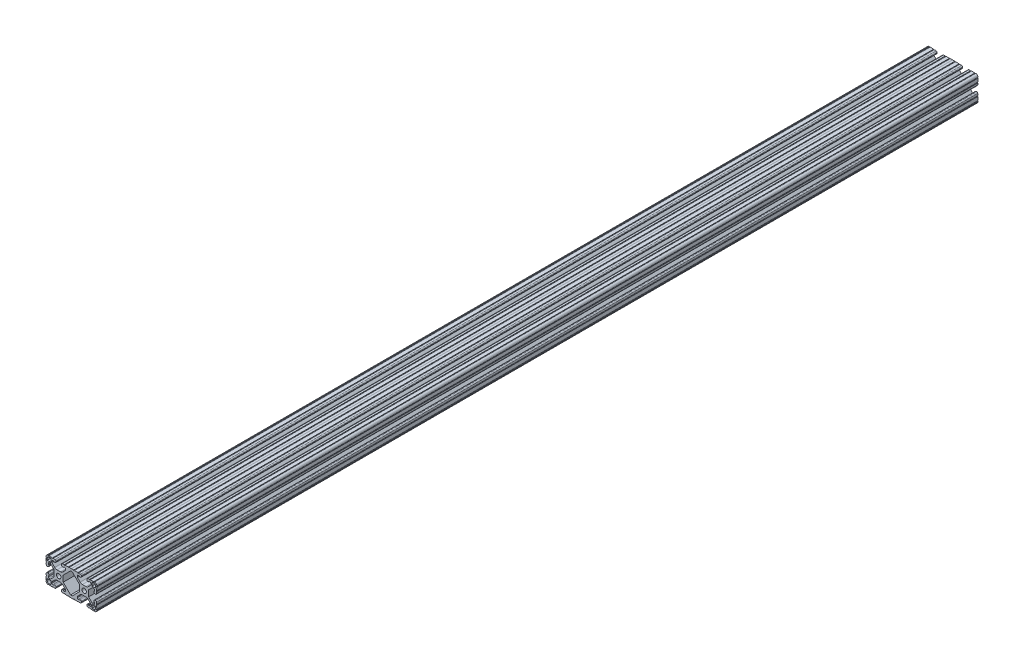
from build123d import *

# Parameters (mm, degrees)
SKETCH3_R          = 3.3274
EXTRUDE1_DEPTH     = 914.4
SKETCH4_W          = 79.082688122
SKETCH4_H          = 39.718116723
CUT_EXTRUDE1_DEPTH = 508


with BuildPart() as part:
    # Sketch3 → Extrude1 (new, symmetric)
    with BuildSketch(Plane.XY):
        with BuildLine():
            Line((15.764194098, 19.048065876), (19.05, 19.16278985))
            Line((19.05, 19.16278985), (22.335805902, 19.048065876))
            Line((22.335805902, 19.048065876), (22.405105476, 19.045645881))
            ThreePointArc((22.405105476, 19.045645881), (22.993059391, 18.4151425), (23.623562772, 19.003096415))
            Line((23.623562772, 19.003096415), (28.755105476, 18.823898995))
            ThreePointArc((28.755105476, 18.823898995), (29.343059391, 18.193395614), (29.973562772, 18.781349529))
            Line((29.973562772, 18.781349529), (32.517119053, 18.692526586))
            ThreePointArc((32.517119053, 18.692526586), (33.613895135, 18.192696929), (34.036, 17.063726184))
            Line((34.036, 17.063726184), (34.007633689, 16.25142132))
            ThreePointArc((34.007633689, 16.25142132), (33.507804032, 15.154645238), (32.378833287, 14.732540373))
            Line((32.378833287, 14.732540373), (31.2293, 14.732540373))
            Line((31.2293, 14.732540373), (31.2293, 15.644526586))
            Line((31.2293, 15.644526586), (29.083, 15.644526586))
            ThreePointArc((29.083, 15.644526586), (28.184974388, 15.272552198), (27.813, 14.374526586))
            Line((27.813, 14.374526586), (27.813, 12.968312693))
            ThreePointArc((27.813, 12.968312693), (27.909672994, 12.482304734), (28.184974388, 12.070287081))
            Line((28.184974388, 12.070287081), (32.107677258, 8.147584211))
            ThreePointArc((32.107677258, 8.147584211), (33.648623281, 7.117956996), (35.466293048, 6.7564))
            Line((35.466293048, 6.7564), (40.733706952, 6.7564))
            ThreePointArc((40.733706952, 6.7564), (42.551376719, 7.117956996), (44.092322742, 8.147584211))
            Line((44.092322742, 8.147584211), (48.015025612, 12.070287081))
            ThreePointArc((48.015025612, 12.070287081), (48.290327006, 12.482304734), (48.387, 12.968312693))
            Line((48.387, 12.968312693), (48.387, 14.374526586))
            ThreePointArc((48.387, 14.374526586), (48.015025612, 15.272552198), (47.117, 15.644526586))
            Line((47.117, 15.644526586), (44.9707, 15.644526586))
            Line((44.9707, 15.644526586), (44.9707, 14.732540373))
            Line((44.9707, 14.732540373), (43.821166713, 14.732540373))
            ThreePointArc((43.821166713, 14.732540373), (42.692195968, 15.154645238), (42.192366311, 16.25142132))
            Line((42.192366311, 16.25142132), (42.164, 17.063726184))
            ThreePointArc((42.164, 17.063726184), (42.586104865, 18.192696929), (43.682880947, 18.692526586))
            Line((43.682880947, 18.692526586), (46.226437228, 18.781349529))
            ThreePointArc((46.226437228, 18.781349529), (46.856940609, 18.193395614), (47.444894524, 18.823898995))
            Line((47.444894524, 18.823898995), (52.576437228, 19.003096415))
            ThreePointArc((52.576437228, 19.003096415), (53.206940609, 18.4151425), (53.794894524, 19.045645881))
            Line((53.794894524, 19.045645881), (53.864194098, 19.048065876))
            ThreePointArc((53.864194098, 19.048065876), (56.22006403, 18.12006403), (57.148065876, 15.764194098))
            Line((57.148065876, 15.764194098), (57.145645881, 15.694894524))
            ThreePointArc((57.145645881, 15.694894524), (56.5151425, 15.106940609), (57.103096415, 14.476437228))
            Line((57.103096415, 14.476437228), (56.923898995, 9.344894524))
            ThreePointArc((56.923898995, 9.344894524), (56.293395614, 8.756940609), (56.881349529, 8.126437228))
            Line((56.881349529, 8.126437228), (56.792526586, 5.582880947))
            ThreePointArc((56.792526586, 5.582880947), (56.292696929, 4.486104865), (55.163726184, 4.064))
            Line((55.163726184, 4.064), (54.35142132, 4.092366311))
            ThreePointArc((54.35142132, 4.092366311), (53.254645238, 4.592195968), (52.832540373, 5.721166713))
            Line((52.832540373, 5.721166713), (52.832540373, 6.8707))
            Line((52.832540373, 6.8707), (53.744526586, 6.8707))
            Line((53.744526586, 6.8707), (53.744526586, 9.017))
            ThreePointArc((53.744526586, 9.017), (53.372552198, 9.915025612), (52.474526586, 10.287))
            Line((52.474526586, 10.287), (50.542261469, 10.287))
            Line((50.542261469, 10.287), (44.8564, 4.601138531))
            Line((44.8564, 4.601138531), (44.8564, -4.601138531))
            Line((44.8564, -4.601138531), (50.542261469, -10.287))
            Line((50.542261469, -10.287), (52.474526586, -10.287))
            ThreePointArc((52.474526586, -10.287), (53.372552198, -9.915025612), (53.744526586, -9.017))
            Line((53.744526586, -9.017), (53.744526586, -6.8707))
            Line((53.744526586, -6.8707), (52.832540373, -6.8707))
            Line((52.832540373, -6.8707), (52.832540373, -5.721166713))
            ThreePointArc((52.832540373, -5.721166713), (53.254645238, -4.592195968), (54.35142132, -4.092366311))
            Line((54.35142132, -4.092366311), (55.163726184, -4.064))
            ThreePointArc((55.163726184, -4.064), (56.292696929, -4.486104865), (56.792526586, -5.582880947))
            Line((56.792526586, -5.582880947), (56.881349529, -8.126437228))
            ThreePointArc((56.881349529, -8.126437228), (56.293395614, -8.756940609), (56.923898995, -9.344894524))
            Line((56.923898995, -9.344894524), (57.103096415, -14.476437228))
            ThreePointArc((57.103096415, -14.476437228), (56.5151425, -15.106940609), (57.145645881, -15.694894524))
            Line((57.145645881, -15.694894524), (57.148065876, -15.764194098))
            ThreePointArc((57.148065876, -15.764194098), (56.22006403, -18.12006403), (53.864194098, -19.048065876))
            Line((53.864194098, -19.048065876), (53.794894524, -19.045645881))
            ThreePointArc((53.794894524, -19.045645881), (53.206940609, -18.4151425), (52.576437228, -19.003096415))
            Line((52.576437228, -19.003096415), (47.444894524, -18.823898995))
            ThreePointArc((47.444894524, -18.823898995), (46.856940609, -18.193395614), (46.226437228, -18.781349529))
            Line((46.226437228, -18.781349529), (43.682880947, -18.692526586))
            ThreePointArc((43.682880947, -18.692526586), (42.586104865, -18.192696929), (42.164, -17.063726184))
            Line((42.164, -17.063726184), (42.192366311, -16.25142132))
            ThreePointArc((42.192366311, -16.25142132), (42.692195968, -15.154645238), (43.821166713, -14.732540373))
            Line((43.821166713, -14.732540373), (44.9707, -14.732540373))
            Line((44.9707, -14.732540373), (44.9707, -15.644526586))
            Line((44.9707, -15.644526586), (47.117, -15.644526586))
            ThreePointArc((47.117, -15.644526586), (48.015025612, -15.272552198), (48.387, -14.374526586))
            Line((48.387, -14.374526586), (48.387, -12.968312693))
            ThreePointArc((48.387, -12.968312693), (48.290327006, -12.482304734), (48.015025612, -12.070287081))
            Line((48.015025612, -12.070287081), (44.092322742, -8.147584211))
            ThreePointArc((44.092322742, -8.147584211), (42.551376719, -7.117956996), (40.733706952, -6.7564))
            Line((40.733706952, -6.7564), (35.466293048, -6.7564))
            ThreePointArc((35.466293048, -6.7564), (33.648623281, -7.117956996), (32.107677258, -8.147584211))
            Line((32.107677258, -8.147584211), (28.184974388, -12.070287081))
            ThreePointArc((28.184974388, -12.070287081), (27.909672994, -12.482304734), (27.813, -12.968312693))
            Line((27.813, -12.968312693), (27.813, -14.374526586))
            ThreePointArc((27.813, -14.374526586), (28.184974388, -15.272552198), (29.083, -15.644526586))
            Line((29.083, -15.644526586), (31.2293, -15.644526586))
            Line((31.2293, -15.644526586), (31.2293, -14.732540373))
            Line((31.2293, -14.732540373), (32.378833287, -14.732540373))
            ThreePointArc((32.378833287, -14.732540373), (33.507804032, -15.154645238), (34.007633689, -16.25142132))
            Line((34.007633689, -16.25142132), (34.036, -17.063726184))
            ThreePointArc((34.036, -17.063726184), (33.613895135, -18.192696929), (32.517119053, -18.692526586))
            Line((32.517119053, -18.692526586), (29.973562772, -18.781349529))
            ThreePointArc((29.973562772, -18.781349529), (29.343059391, -18.193395614), (28.755105476, -18.823898995))
            Line((28.755105476, -18.823898995), (23.623562772, -19.003096415))
            ThreePointArc((23.623562772, -19.003096415), (22.993059391, -18.4151425), (22.405105476, -19.045645881))
            Line((22.405105476, -19.045645881), (22.335805902, -19.048065876))
            Line((22.335805902, -19.048065876), (19.05, -19.16278985))
            Line((19.05, -19.16278985), (15.764194098, -19.048065876))
            Line((15.764194098, -19.048065876), (15.694894524, -19.045645881))
            ThreePointArc((15.694894524, -19.045645881), (15.106940609, -18.4151425), (14.476437228, -19.003096415))
            Line((14.476437228, -19.003096415), (9.344894524, -18.823898995))
            ThreePointArc((9.344894524, -18.823898995), (8.756940609, -18.193395614), (8.126437228, -18.781349529))
            Line((8.126437228, -18.781349529), (5.582880947, -18.692526586))
            ThreePointArc((5.582880947, -18.692526586), (4.486104865, -18.192696929), (4.064, -17.063726184))
            Line((4.064, -17.063726184), (4.092366311, -16.25142132))
            ThreePointArc((4.092366311, -16.25142132), (4.592195968, -15.154645238), (5.721166713, -14.732540373))
            Line((5.721166713, -14.732540373), (6.8707, -14.732540373))
            Line((6.8707, -14.732540373), (6.8707, -15.644526586))
            Line((6.8707, -15.644526586), (9.017, -15.644526586))
            ThreePointArc((9.017, -15.644526586), (9.915025612, -15.272552198), (10.287, -14.374526586))
            Line((10.287, -14.374526586), (10.287, -12.968312693))
            ThreePointArc((10.287, -12.968312693), (10.190327006, -12.482304734), (9.915025612, -12.070287081))
            Line((9.915025612, -12.070287081), (5.992322742, -8.147584211))
            ThreePointArc((5.992322742, -8.147584211), (4.451376719, -7.117956996), (2.633706952, -6.7564))
            Line((2.633706952, -6.7564), (-2.633706952, -6.7564))
            ThreePointArc((-2.633706952, -6.7564), (-4.451376719, -7.117956996), (-5.992322742, -8.147584211))
            Line((-5.992322742, -8.147584211), (-9.915025612, -12.070287081))
            ThreePointArc((-9.915025612, -12.070287081), (-10.190327006, -12.482304734), (-10.287, -12.968312693))
            Line((-10.287, -12.968312693), (-10.287, -14.374526586))
            ThreePointArc((-10.287, -14.374526586), (-9.915025612, -15.272552198), (-9.017, -15.644526586))
            Line((-9.017, -15.644526586), (-6.8707, -15.644526586))
            Line((-6.8707, -15.644526586), (-6.8707, -14.732540373))
            Line((-6.8707, -14.732540373), (-5.721166713, -14.732540373))
            ThreePointArc((-5.721166713, -14.732540373), (-4.592195968, -15.154645238), (-4.092366311, -16.25142132))
            Line((-4.092366311, -16.25142132), (-4.064, -17.063726184))
            ThreePointArc((-4.064, -17.063726184), (-4.486104865, -18.192696929), (-5.582880947, -18.692526586))
            Line((-5.582880947, -18.692526586), (-8.126437228, -18.781349529))
            ThreePointArc((-8.126437228, -18.781349529), (-8.756940609, -18.193395614), (-9.344894524, -18.823898995))
            Line((-9.344894524, -18.823898995), (-14.476437228, -19.003096415))
            ThreePointArc((-14.476437228, -19.003096415), (-15.106940609, -18.4151425), (-15.694894524, -19.045645881))
            Line((-15.694894524, -19.045645881), (-15.764194098, -19.048065876))
            ThreePointArc((-15.764194098, -19.048065876), (-18.12006403, -18.12006403), (-19.048065876, -15.764194098))
            Line((-19.048065876, -15.764194098), (-19.045645881, -15.694894524))
            ThreePointArc((-19.045645881, -15.694894524), (-18.4151425, -15.106940609), (-19.003096415, -14.476437228))
            Line((-19.003096415, -14.476437228), (-18.823898995, -9.344894524))
            ThreePointArc((-18.823898995, -9.344894524), (-18.193395614, -8.756940609), (-18.781349529, -8.126437228))
            Line((-18.781349529, -8.126437228), (-18.692526586, -5.582880947))
            ThreePointArc((-18.692526586, -5.582880947), (-18.192696929, -4.486104865), (-17.063726184, -4.064))
            Line((-17.063726184, -4.064), (-16.25142132, -4.092366311))
            ThreePointArc((-16.25142132, -4.092366311), (-15.154645238, -4.592195968), (-14.732540373, -5.721166713))
            Line((-14.732540373, -5.721166713), (-14.732540373, -6.8707))
            Line((-14.732540373, -6.8707), (-15.644526586, -6.8707))
            Line((-15.644526586, -6.8707), (-15.644526586, -9.017))
            ThreePointArc((-15.644526586, -9.017), (-15.272552198, -9.915025612), (-14.374526586, -10.287))
            Line((-14.374526586, -10.287), (-12.442261469, -10.287))
            Line((-12.442261469, -10.287), (-6.7564, -4.601138531))
            Line((-6.7564, -4.601138531), (-6.7564, 4.601138531))
            Line((-6.7564, 4.601138531), (-12.442261469, 10.287))
            Line((-12.442261469, 10.287), (-14.374526586, 10.287))
            ThreePointArc((-14.374526586, 10.287), (-15.272552198, 9.915025612), (-15.644526586, 9.017))
            Line((-15.644526586, 9.017), (-15.644526586, 6.8707))
            Line((-15.644526586, 6.8707), (-14.732540373, 6.8707))
            Line((-14.732540373, 6.8707), (-14.732540373, 5.721166713))
            ThreePointArc((-14.732540373, 5.721166713), (-15.154645238, 4.592195968), (-16.25142132, 4.092366311))
            Line((-16.25142132, 4.092366311), (-17.063726184, 4.064))
            ThreePointArc((-17.063726184, 4.064), (-18.192696929, 4.486104865), (-18.692526586, 5.582880947))
            Line((-18.692526586, 5.582880947), (-18.781349529, 8.126437228))
            ThreePointArc((-18.781349529, 8.126437228), (-18.193395614, 8.756940609), (-18.823898995, 9.344894524))
            Line((-18.823898995, 9.344894524), (-19.003096415, 14.476437228))
            ThreePointArc((-19.003096415, 14.476437228), (-18.4151425, 15.106940609), (-19.045645881, 15.694894524))
            Line((-19.045645881, 15.694894524), (-19.048065876, 15.764194098))
            ThreePointArc((-19.048065876, 15.764194098), (-18.12006403, 18.12006403), (-15.764194098, 19.048065876))
            Line((-15.764194098, 19.048065876), (-15.694894524, 19.045645881))
            ThreePointArc((-15.694894524, 19.045645881), (-15.106940609, 18.4151425), (-14.476437228, 19.003096415))
            Line((-14.476437228, 19.003096415), (-9.344894524, 18.823898995))
            ThreePointArc((-9.344894524, 18.823898995), (-8.756940609, 18.193395614), (-8.126437228, 18.781349529))
            Line((-8.126437228, 18.781349529), (-5.582880947, 18.692526586))
            ThreePointArc((-5.582880947, 18.692526586), (-4.486104865, 18.192696929), (-4.064, 17.063726184))
            Line((-4.064, 17.063726184), (-4.092366311, 16.25142132))
            ThreePointArc((-4.092366311, 16.25142132), (-4.592195968, 15.154645238), (-5.721166713, 14.732540373))
            Line((-5.721166713, 14.732540373), (-6.8707, 14.732540373))
            Line((-6.8707, 14.732540373), (-6.8707, 15.644526586))
            Line((-6.8707, 15.644526586), (-9.017, 15.644526586))
            ThreePointArc((-9.017, 15.644526586), (-9.915025612, 15.272552198), (-10.287, 14.374526586))
            Line((-10.287, 14.374526586), (-10.287, 12.968312693))
            ThreePointArc((-10.287, 12.968312693), (-10.190327006, 12.482304734), (-9.915025612, 12.070287081))
            Line((-9.915025612, 12.070287081), (-5.992322742, 8.147584211))
            ThreePointArc((-5.992322742, 8.147584211), (-4.451376719, 7.117956996), (-2.633706952, 6.7564))
            Line((-2.633706952, 6.7564), (2.633706952, 6.7564))
            ThreePointArc((2.633706952, 6.7564), (4.451376719, 7.117956996), (5.992322742, 8.147584211))
            Line((5.992322742, 8.147584211), (9.915025612, 12.070287081))
            ThreePointArc((9.915025612, 12.070287081), (10.190327006, 12.482304734), (10.287, 12.968312693))
            Line((10.287, 12.968312693), (10.287, 14.374526586))
            ThreePointArc((10.287, 14.374526586), (9.915025612, 15.272552198), (9.017, 15.644526586))
            Line((9.017, 15.644526586), (6.8707, 15.644526586))
            Line((6.8707, 15.644526586), (6.8707, 14.732540373))
            Line((6.8707, 14.732540373), (5.721166713, 14.732540373))
            ThreePointArc((5.721166713, 14.732540373), (4.592195968, 15.154645238), (4.092366311, 16.25142132))
            Line((4.092366311, 16.25142132), (4.064, 17.063726184))
            ThreePointArc((4.064, 17.063726184), (4.486104865, 18.192696929), (5.582880947, 18.692526586))
            Line((5.582880947, 18.692526586), (8.126437228, 18.781349529))
            ThreePointArc((8.126437228, 18.781349529), (8.756940609, 18.193395614), (9.344894524, 18.823898995))
            Line((9.344894524, 18.823898995), (14.476437228, 19.003096415))
            ThreePointArc((14.476437228, 19.003096415), (15.106940609, 18.4151425), (15.694894524, 19.045645881))
            Line((15.694894524, 19.045645881), (15.764194098, 19.048065876))
        make_face()
        Circle(SKETCH3_R, mode=Mode.SUBTRACT)
        with Locations(Location((38.1, 0, 0), (0, 0, 180))):
            Circle(SKETCH3_R, mode=Mode.SUBTRACT)
        Polygon((17.799788055, 15.644526586), (20.300211945, 15.644526586), (31.3436, 4.601138531), (31.3436, -4.601138531), (20.300211945, -15.644526586), (17.799788055, -15.644526586), (6.7564, -4.601138531), (6.7564, 4.601138531), align=None, mode=Mode.SUBTRACT)
        with BuildLine():
            Line((-11.8364, 11.8364), (-11.8364, 17.2212))
            Line((-11.8364, 17.2212), (-14.4272, 17.2212))
            ThreePointArc((-14.4272, 17.2212), (-16.402856347, 16.402856347), (-17.2212, 14.4272))
            Line((-17.2212, 14.4272), (-17.2212, 11.8364))
            Line((-17.2212, 11.8364), (-11.8364, 11.8364))
        make_face(mode=Mode.SUBTRACT)
        with BuildLine():
            Line((49.9364, -11.8364), (49.9364, -17.2212))
            Line((49.9364, -17.2212), (52.5272, -17.2212))
            ThreePointArc((52.5272, -17.2212), (54.502856347, -16.402856347), (55.3212, -14.4272))
            Line((55.3212, -14.4272), (55.3212, -11.8364))
            Line((55.3212, -11.8364), (49.9364, -11.8364))
        make_face(mode=Mode.SUBTRACT)
        with BuildLine():
            Line((-11.8364, -17.2212), (-14.4272, -17.2212))
            ThreePointArc((-14.4272, -17.2212), (-16.402856347, -16.402856347), (-17.2212, -14.4272))
            Line((-17.2212, -14.4272), (-17.2212, -11.8364))
            Line((-17.2212, -11.8364), (-11.8364, -11.8364))
            Line((-11.8364, -11.8364), (-11.8364, -17.2212))
        make_face(mode=Mode.SUBTRACT)
        with BuildLine():
            Line((49.9364, 17.2212), (52.5272, 17.2212))
            ThreePointArc((52.5272, 17.2212), (54.502856347, 16.402856347), (55.3212, 14.4272))
            Line((55.3212, 14.4272), (55.3212, 11.8364))
            Line((55.3212, 11.8364), (49.9364, 11.8364))
            Line((49.9364, 11.8364), (49.9364, 17.2212))
        make_face(mode=Mode.SUBTRACT)
    extrude(amount=EXTRUDE1_DEPTH, both=True)

    # Sketch4 → Cut-Extrude1 (cut)
    with BuildSketch(Plane(origin=(0, 0, -914.4), x_dir=(-1, 0, 0), z_dir=(0, 0, -1))):
        with Locations((-19.21807961, -0.21217606)):
            Rectangle(SKETCH4_W, SKETCH4_H)
    extrude(amount=-CUT_EXTRUDE1_DEPTH, mode=Mode.SUBTRACT)


solid = part.part
